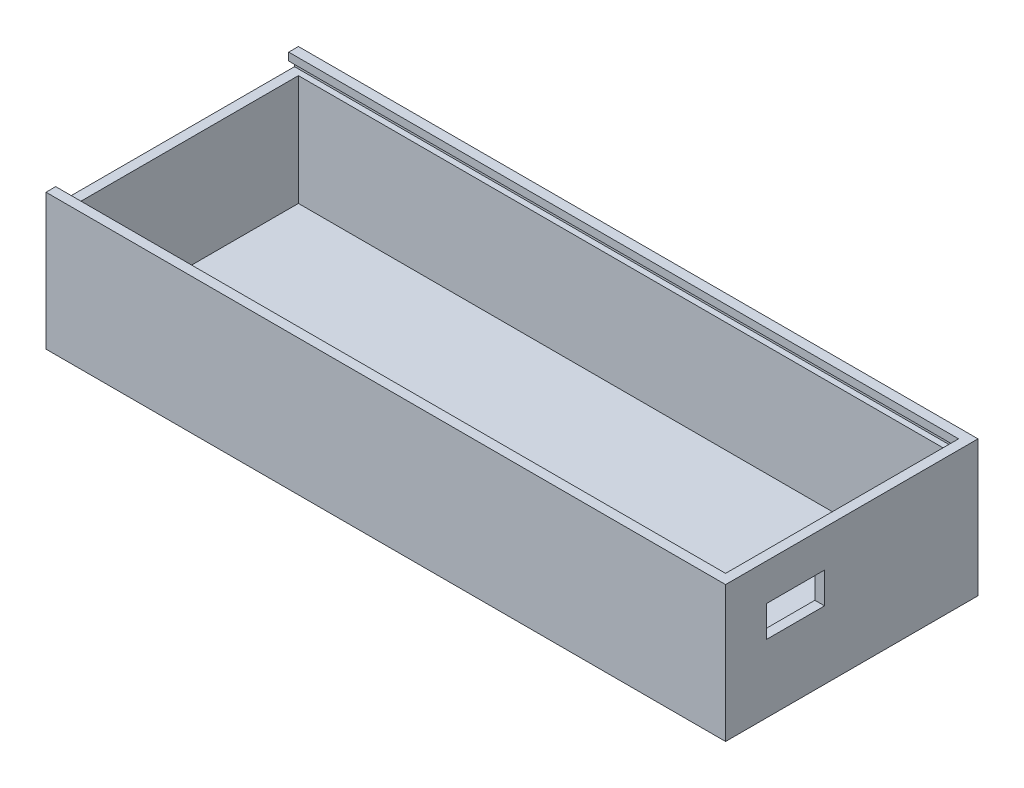
from build123d import *

# Parameters (mm, degrees)
SKETCH2_W           = 175
SKETCH2_H           = 65
BOSS_EXTRUDE1_DEPTH = 35
SKETCH3_W           = 170
SKETCH3_H           = 60
CUT_EXTRUDE1_DEPTH  = 32.5
SKETCH4_W           = 15
SKETCH4_H           = 8
CUT_EXTRUDE3_DEPTH  = 172.5
SKETCH5_W           = 63
SKETCH5_H           = 2
CUT_EXTRUDE5_DEPTH  = 173.5
SKETCH7_W           = 60
SKETCH7_H           = 2
CUT_EXTRUDE6_DEPTH  = 2.5


with BuildPart() as part:
    # Sketch2 → Boss-Extrude1 (new body)
    with BuildSketch(Plane(origin=(0, 0, 0), x_dir=(1, 0, 0), z_dir=(0, 1, 0))):
        with Locations((-4.104793892, 27.168582034)):
            Rectangle(SKETCH2_W, SKETCH2_H)
    extrude(amount=BOSS_EXTRUDE1_DEPTH)

    # Sketch3 → Cut-Extrude1 (cut)
    with BuildSketch(Plane(origin=(0, 35, 0), x_dir=(1, 0, 0), z_dir=(0, 1, 0))):
        with Locations((-4.104793892, 27.168582034)):
            Rectangle(SKETCH3_W, SKETCH3_H)
    extrude(amount=-CUT_EXTRUDE1_DEPTH, mode=Mode.SUBTRACT)

    # Sketch4 → Cut-Extrude3 (cut)
    with BuildSketch(Plane(origin=(83.395206108, 0, 0), x_dir=(0, 0, -1), z_dir=(1, 0, 0))):
        with Locations((12.668582034, 21.5)):
            Rectangle(SKETCH4_W, SKETCH4_H)
    extrude(amount=-CUT_EXTRUDE3_DEPTH, mode=Mode.SUBTRACT)

    # Sketch5 → Cut-Extrude5 (cut)
    with BuildSketch(Plane.ZY.offset(91.604793892)):
        with Locations((-27.168582034, 32)):
            Rectangle(SKETCH5_W, SKETCH5_H)
    extrude(amount=-CUT_EXTRUDE5_DEPTH, mode=Mode.SUBTRACT)

    # Sketch7 → Cut-Extrude6 (cut)
    with BuildSketch(Plane.ZY.offset(91.604793892)):
        with Locations((-27.168582034, 34)):
            Rectangle(SKETCH7_W, SKETCH7_H)
    extrude(amount=-CUT_EXTRUDE6_DEPTH, mode=Mode.SUBTRACT)


solid = part.part
